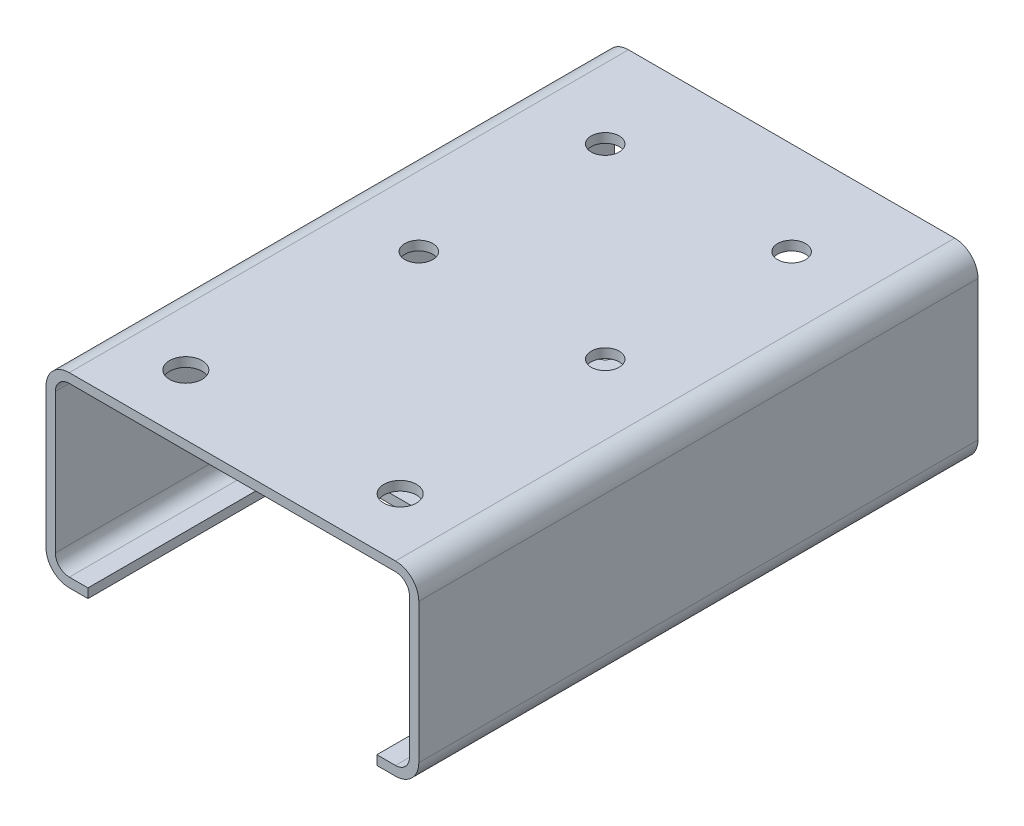
from build123d import *

# Parameters (mm, degrees)
AUFSATZ_LINEAR_AUSTRAGEN1_DEPTH = 120
SCHNITT_LINEAR_AUSTRAGEN1_DEPTH = 10
SKIZZE3_R                       = 3
SKIZZE3_R_2                     = 3.5
SCHNITT_LINEAR_AUSTRAGEN2_DEPTH = 60


with BuildPart() as part:
    # Skizze1 → Aufsatz-Linear austragen1 (new body)
    with BuildSketch(Plane.XY):
        with BuildLine():
            Line((0, 35), (0, 5))
            ThreePointArc((0, 5), (1.464466094, 1.464466094), (5, 0))
            Line((5, 0), (75, 0))
            ThreePointArc((75, 0), (78.535533906, 1.464466094), (80, 5))
            Line((80, 5), (80, 35))
            ThreePointArc((80, 35), (78.535533906, 38.535533906), (75, 40))
            Line((75, 40), (5, 40))
            ThreePointArc((5, 40), (1.464466094, 38.535533906), (0, 35))
        make_face()
        with BuildLine():
            Line((78, 5), (78, 35))
            ThreePointArc((78, 35), (77.121320344, 37.121320344), (75, 38))
            Line((75, 38), (5, 38))
            ThreePointArc((5, 38), (2.878679656, 37.121320344), (2, 35))
            Line((2, 35), (2, 5))
            ThreePointArc((2, 5), (2.878679656, 2.878679656), (5, 2))
            Line((5, 2), (75, 2))
            ThreePointArc((75, 2), (77.121320344, 2.878679656), (78, 5))
        make_face(mode=Mode.SUBTRACT)
    extrude(amount=AUFSATZ_LINEAR_AUSTRAGEN1_DEPTH)

    # Skizze2 → Schnitt-Linear austragen1 (cut)
    with BuildSketch(Plane.XZ):
        with BuildLine():
            Line((9, 120), (71, 120))
            Line((71, 120), (71, 75))
            ThreePointArc((71, 75), (69.535533906, 71.464466094), (66, 70))
            Line((66, 70), (14, 70))
            ThreePointArc((14, 70), (10.464466094, 71.464466094), (9, 75))
            Line((9, 75), (9, 120))
        make_face()
    extrude(amount=-SCHNITT_LINEAR_AUSTRAGEN1_DEPTH, mode=Mode.SUBTRACT)

    # Skizze3 → Schnitt-Linear austragen2 (cut)
    with BuildSketch(Plane(origin=(0, 40, 0), x_dir=(1, 0, 0), z_dir=(0, 1, 0))):
        with Locations(Location((60, -20, 0), (0, 0, 180))):
            Circle(SKIZZE3_R)
        with Locations(Location((20, -20, 0), (0, 0, 180))):
            Circle(SKIZZE3_R)
        with Locations(Location((60, -60, 0), (0, 0, 180))):
            Circle(SKIZZE3_R)
        with Locations(Location((20, -60, 0), (0, 0, 180))):
            Circle(SKIZZE3_R)
        with Locations(Location((63, -107, 0), (0, 0, 180))):
            Circle(SKIZZE3_R_2)
        with Locations(Location((17, -107, 0), (0, 0, 180))):
            Circle(SKIZZE3_R_2)
    extrude(amount=-SCHNITT_LINEAR_AUSTRAGEN2_DEPTH, mode=Mode.SUBTRACT)


solid = part.part
